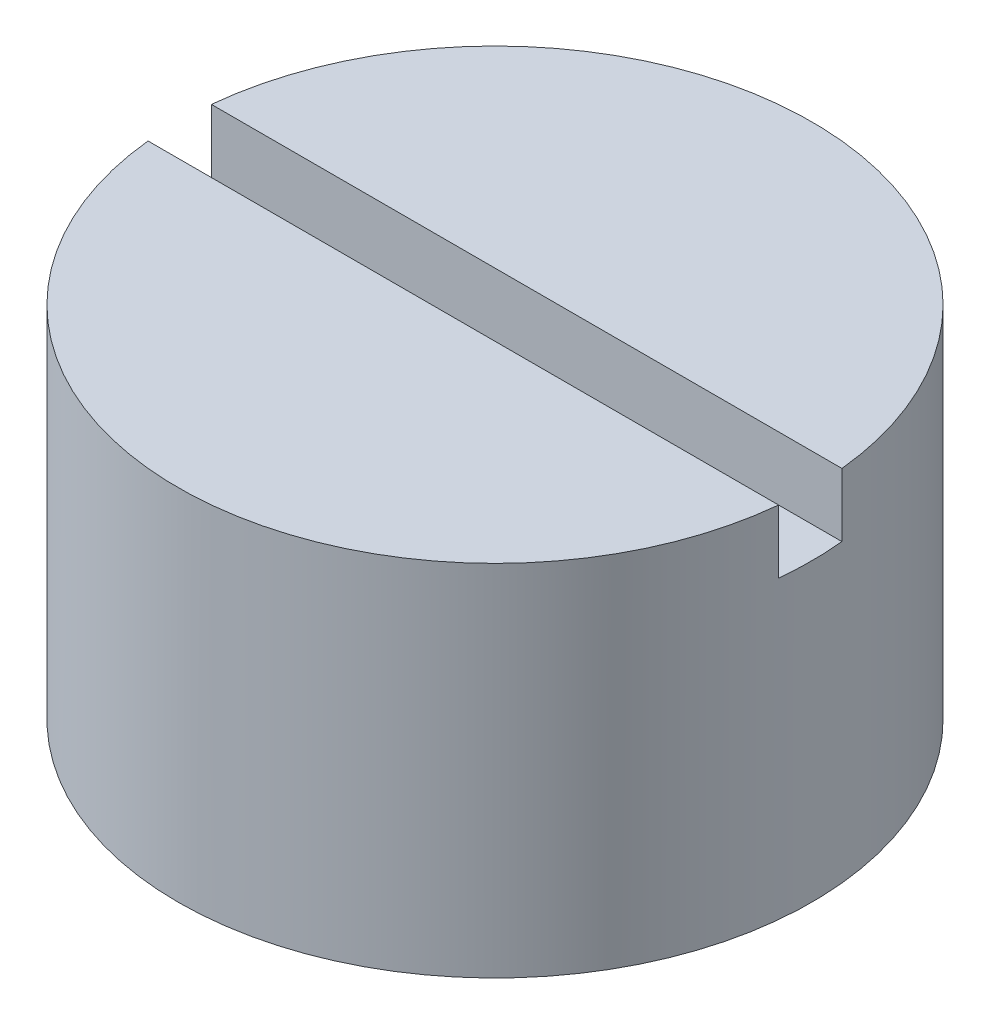
from build123d import *

# Parameters (mm, degrees)
SKETCH2_R           = 15
BOSS_EXTRUDE1_DEPTH = 6
BOSS_EXTRUDE2_START = 5
SKETCH3_R           = 15
BOSS_EXTRUDE2_DEPTH = 5
SKETCH4_W           = 32
SKETCH4_H           = 3
CUT_EXTRUDE1_DEPTH  = 3


with BuildPart() as part:
    # Sketch2 → Boss-Extrude1 (new, symmetric)
    with BuildSketch(Plane(origin=(0, 0, 0), x_dir=(1, 0, 0), z_dir=(0, 1, 0))):
        with Locations(Location((0, 0, 0), (0, 0, 270))):
            Circle(SKETCH2_R)
        Polygon((0, 12.846043489), (-11.125, 6.423021745), (-11.125, -6.423021745), (0, -12.846043489), (11.125, -6.423021745), (11.125, 6.423021745), align=None, mode=Mode.SUBTRACT)
    extrude(amount=BOSS_EXTRUDE1_DEPTH, both=True)

    # Sketch3 → Boss-Extrude2 (add)
    with BuildSketch(Plane(origin=(0, 6, 0), x_dir=(1, 0, 0), z_dir=(0, 1, 0)).offset(BOSS_EXTRUDE2_START)):
        with Locations(Location((0, 0, 0), (0, 0, 270))):
            Circle(SKETCH3_R)
    extrude(amount=-BOSS_EXTRUDE2_DEPTH)

    # Sketch4 → Cut-Extrude1 (cut)
    with BuildSketch(Plane(origin=(0, 11, 0), x_dir=(1, 0, 0), z_dir=(0, 1, 0))):
        Rectangle(SKETCH4_W, SKETCH4_H)
    extrude(amount=-CUT_EXTRUDE1_DEPTH, mode=Mode.SUBTRACT)


solid = part.part
